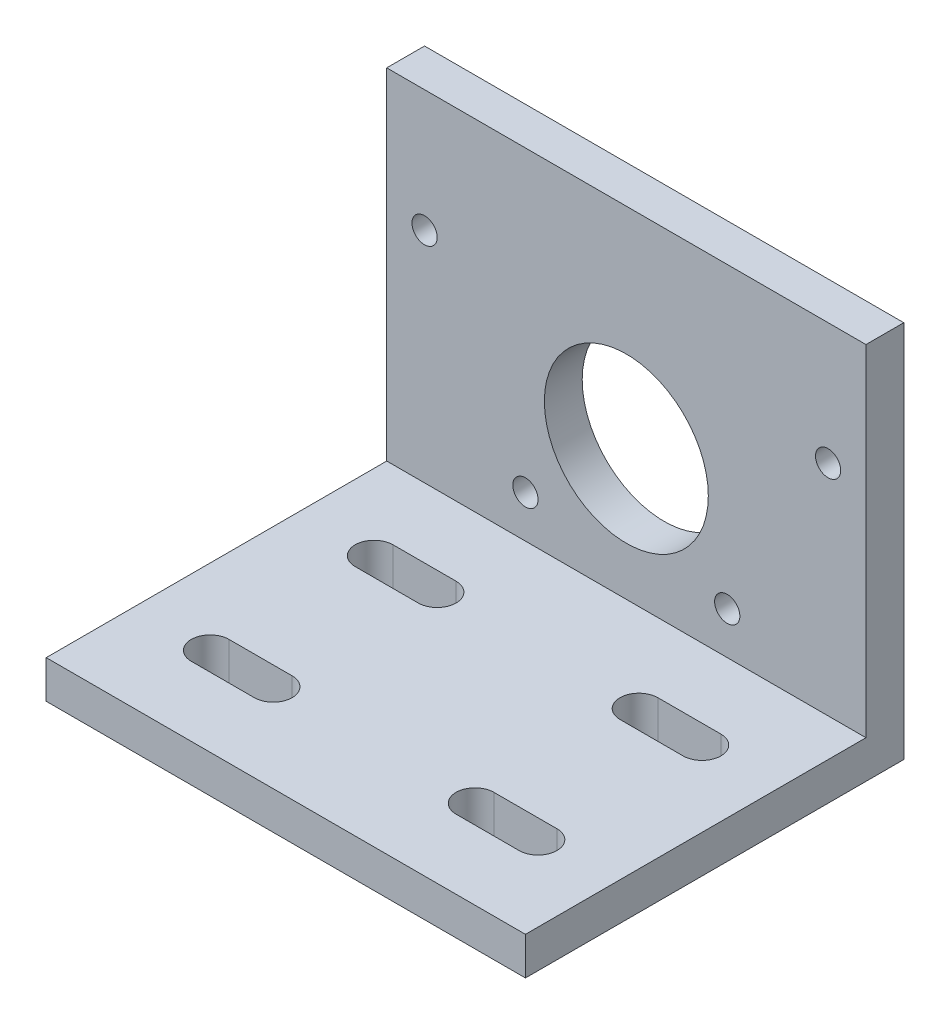
from build123d import *

# Parameters (mm, degrees)
SKETCH2_W           = 38
SKETCH2_H           = 30
BOSS_EXTRUDE1_DEPTH = 3
SKETCH3_W           = 38
SKETCH3_H           = 3
BOSS_EXTRUDE2_DEPTH = 27
SKETCH4_R           = 6.5
CUT_EXTRUDE1_DEPTH  = 27
CUT_EXTRUDE2_DEPTH  = 37.262928729
SKETCH6_R           = 1
CUT_EXTRUDE3_DEPTH  = 45.609416046


with BuildPart() as part:
    # Sketch2 → Boss-Extrude1 (new body)
    with BuildSketch(Plane(origin=(0, 0, 0), x_dir=(1, 0, 0), z_dir=(0, 1, 0))):
        Rectangle(SKETCH2_W, SKETCH2_H)
    extrude(amount=BOSS_EXTRUDE1_DEPTH)

    # Sketch3 → Boss-Extrude2 (add)
    with BuildSketch(Plane(origin=(0, 3, 0), x_dir=(1, 0, 0), z_dir=(0, 1, 0))):
        with Locations((0, 13.5)):
            Rectangle(SKETCH3_W, SKETCH3_H)
    extrude(amount=BOSS_EXTRUDE2_DEPTH)

    # Sketch4 → Cut-Extrude1 (cut)
    with BuildSketch(Plane.XY.offset(-12)):
        with Locations((0, 13.35)):
            Circle(SKETCH4_R)
    extrude(amount=-CUT_EXTRUDE1_DEPTH, mode=Mode.SUBTRACT)

    # Sketch5 → Cut-Extrude2 (cut, through all)
    with BuildSketch(Plane(origin=(0, 3, 0), x_dir=(1, 0, 0), z_dir=(0, 1, 0))):
        with BuildLine():
            Line((-13, 6.5), (-8, 6.5))
            ThreePointArc((-8, 6.5), (-6.5, 5), (-8, 3.5))
            Line((-8, 3.5), (-13, 3.5))
            ThreePointArc((-13, 3.5), (-14.5, 5), (-13, 6.5))
        make_face()
        with BuildLine():
            Line((8, 6.5), (13, 6.5))
            ThreePointArc((13, 6.5), (14.5, 5), (13, 3.5))
            Line((13, 3.5), (8, 3.5))
            ThreePointArc((8, 3.5), (6.5, 5), (8, 6.5))
        make_face()
        with BuildLine():
            Line((8, -6.5), (13, -6.5))
            ThreePointArc((13, -6.5), (14.5, -8), (13, -9.5))
            Line((13, -9.5), (8, -9.5))
            ThreePointArc((8, -9.5), (6.5, -8), (8, -6.5))
        make_face()
        with BuildLine():
            Line((-13, -6.5), (-8, -6.5))
            ThreePointArc((-8, -6.5), (-6.5, -8), (-8, -9.5))
            Line((-8, -9.5), (-13, -9.5))
            ThreePointArc((-13, -9.5), (-14.5, -8), (-13, -6.5))
        make_face()
    extrude(amount=-CUT_EXTRUDE2_DEPTH, mode=Mode.SUBTRACT)

    # Sketch6 → Cut-Extrude3 (cut, through all)
    with BuildSketch(Plane.XY.offset(-12)):
        with Locations((16, 20.35)):
            Circle(SKETCH6_R)
        with Locations((-16, 20.35)):
            Circle(SKETCH6_R)
        with Locations((-8, 6.35)):
            Circle(SKETCH6_R)
        with Locations((8, 6.35)):
            Circle(SKETCH6_R)
    extrude(amount=-CUT_EXTRUDE3_DEPTH, mode=Mode.SUBTRACT)


solid = part.part
